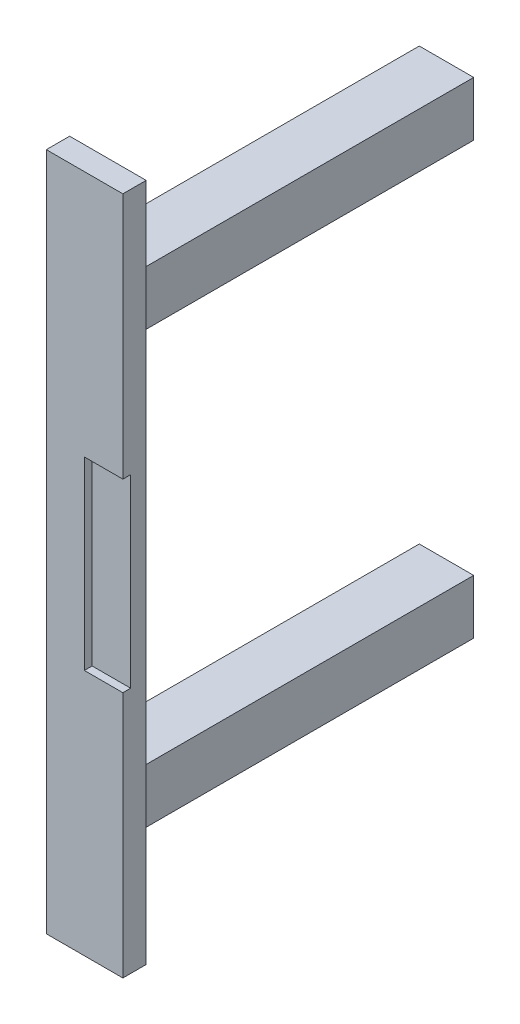
from build123d import *

# Parameters (mm, degrees)
SKETCH1_W           = 20
SKETCH1_H           = 6
BOSS_EXTRUDE1_DEPTH = 174.8
SKETCH2_W           = 20.4
SKETCH2_H           = 47.6
CUT_EXTRUDE1_DEPTH  = 2
SKETCH3_W           = 14
SKETCH3_H           = 14
BOSS_EXTRUDE2_DEPTH = 90
SKETCH4_W           = 0.3
SKETCH4_H           = 6
CUT_EXTRUDE2_DEPTH  = 175


with BuildPart() as part:
    # Sketch1 → Boss-Extrude1 (new body)
    with BuildSketch(Plane(origin=(0, 0, 0), x_dir=(1, 0, 0), z_dir=(0, 1, 0))):
        Rectangle(SKETCH1_W, SKETCH1_H)
    extrude(amount=BOSS_EXTRUDE1_DEPTH)

    # Sketch2 → Cut-Extrude1 (cut)
    with BuildSketch(Plane.XY.offset(3)):
        with Locations((10, 87.4)):
            Rectangle(SKETCH2_W, SKETCH2_H)
    extrude(amount=-CUT_EXTRUDE1_DEPTH, mode=Mode.SUBTRACT)

    # Sketch3 → Boss-Extrude2 (add)
    with BuildSketch(Plane(origin=(0, 0, -3), x_dir=(-1, 0, 0), z_dir=(0, 0, -1))):
        with Locations((3, 31.9)):
            Rectangle(SKETCH3_W, SKETCH3_H)
    boss_extrude2 = extrude(amount=BOSS_EXTRUDE2_DEPTH)

    # Mirror1: Boss-Extrude2 across plane
    add(boss_extrude2.mirror(Plane.ZX.offset(87.4)))

    # Sketch4 → Cut-Extrude2 (cut)
    with BuildSketch(Plane.XZ):
        with Locations((9.85, 0)):
            Rectangle(SKETCH4_W, SKETCH4_H)
    extrude(amount=-CUT_EXTRUDE2_DEPTH, mode=Mode.SUBTRACT)


solid = part.part
